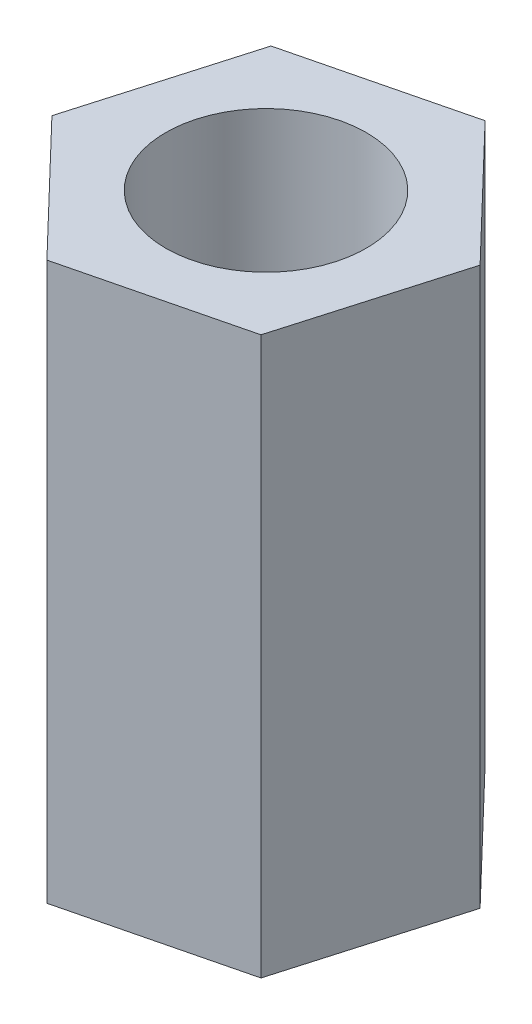
from build123d import *

# Parameters (mm, degrees)
SKETCH1_R           = 1.8
BOSS_EXTRUDE1_DEPTH = 10


with BuildPart() as part:
    # Sketch1 → Boss-Extrude1 (new body)
    with BuildSketch(Plane(origin=(0, 0, 0), x_dir=(1, 0, 0), z_dir=(0, 1, 0))):
        Polygon((2.199834472, -2.289991622), (3.083108155, 0.760116726), (0.883273683, 3.050108348), (-2.199834472, 2.289991622), (-3.083108155, -0.760116726), (-0.883273683, -3.050108348), align=None)
        with Locations(Location((0, 0, 0), (0, 0, 270))):
            Circle(SKETCH1_R, mode=Mode.SUBTRACT)
    extrude(amount=BOSS_EXTRUDE1_DEPTH)


solid = part.part
